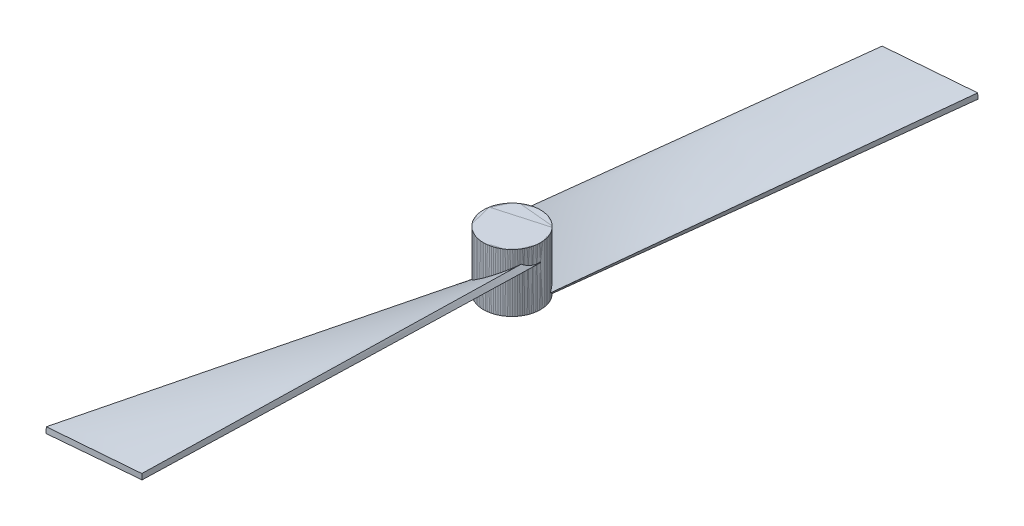
from build123d import *

# Parameters (mm, degrees)
SKETCH6_W          = 5
SKETCH6_H          = 10.2
THICKEN5_T1        = 1
CUT_EXTRUDE1_DEPTH = 6.2
CIRPATTERN4_COUNT  = 2


with BuildPart() as part:
    # Sketch6 → Revolve5 (revolve)
    with BuildSketch(Plane.XY):
        Rectangle(SKETCH6_W, SKETCH6_H)
    revolve(axis=Axis((2.5, 5.1, 0), (0, -1, 0)))

    # Surface-Loft5: a surface lofted through 2 sketches
    with BuildLine(Plane(origin=(0, 0, 0), x_dir=(1, 0, 0), z_dir=(0, 1, 0)), mode=Mode.PRIVATE) as surface_loft5_1_s0:
        Line((2.5, -65.051963771), (-13.010185421, -66.326633559))
    with BuildLine(Plane.XY, mode=Mode.PRIVATE) as surface_loft5_1_s1:
        Line((-1.553541628, -4.1), (6.934939118, 2.890789302))
    surface_loft5_1 = Shell.make_loft([surface_loft5_1_s0.wire(), surface_loft5_1_s1.wire()])
    add(Solid.thicken(surface_loft5_1, THICKEN5_T1))

    # Sketch19 → Cut-Extrude1 (cut)
    with BuildSketch(Plane.XZ.offset(5.1)):
        Polygon((2.835399305, -2.296586011), (4.65660148, -0.857828687), (4.321202175, 1.438757324), (2.164600695, 2.296586011), (0.34339852, 0.857828687), (0.678797825, -1.438757324), align=None)
    extrude(amount=-CUT_EXTRUDE1_DEPTH, mode=Mode.SUBTRACT)


with BuildPart() as cirpattern4_1:
    # CirPattern4: pattern copy
    add(part.part.rotate(Axis((2.5, 5.1, 0), (0, -1, 0)), 1 * 360 / CIRPATTERN4_COUNT))


solid = Compound([part.part, cirpattern4_1.part])
